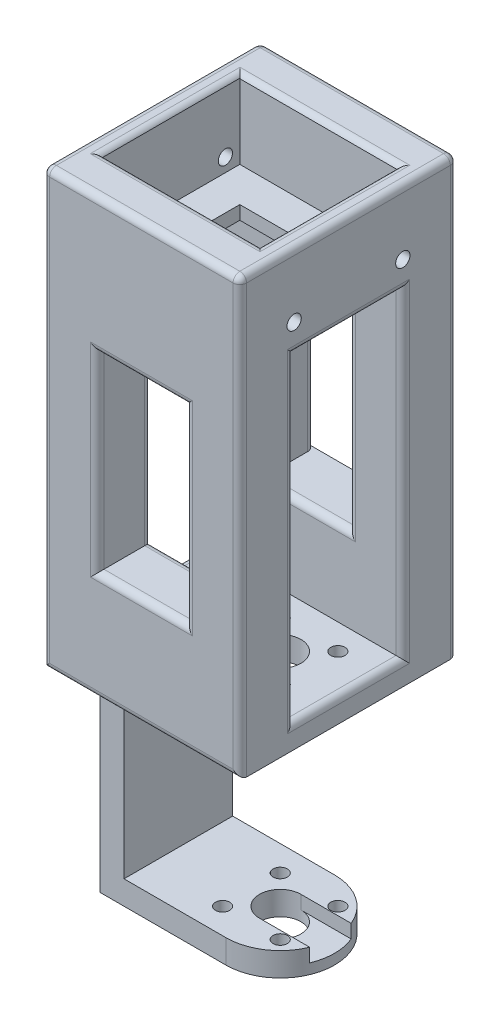
from build123d import *

# Parameters (mm, degrees)
SKETCH_1_R          = 3.05
SKETCH_1_R_2        = 1.05
EXTRUDE_1_DEPTH     = 3.5
SKETCH_2_W          = 16
SKETCH_2_H          = 36
EXTRUDE_2_DEPTH     = 3.5
EXTRUDE_4_DEPTH     = 3.5
EXTRUDE_5_DEPTH     = 8
CUT_EXTRUDE_1_REACH = 104.026
SKETCH_6_W          = 2.03
SKETCH_6_H          = 11.5
EXTRUDE_6_REACH     = 103.73
SKETCH_7_W          = 3
SKETCH_7_H          = 11.5
EXTRUDE_7_REACH     = 103.229
SKETCH_8_W          = 0.45
SKETCH_8_H          = 3.5
EXTRUDE_8_REACH     = 103.229
SKETCH_9_W          = 29
SKETCH_9_H          = 2
SKETCH_10_R         = 1.05
CUT_EXTRUDE_2_DEPTH = 31.75
CUT_EXTRUDE_3_DEPTH = 2
CUT_EXTRUDE_4_REACH = 88.626
SKETCH_13_W         = 11
SKETCH_13_H         = 10
SKETCH_14_W         = 13
SKETCH_14_H         = 28
CUT_EXTRUDE_5_DEPTH = 104.418337349
FILLET_1_R          = 1
CUT_EXTRUDE_6_DEPTH = 11.625
CUT_EXTRUDE_7_DEPTH = 10.125
CUT_EXTRUDE_8_DEPTH = 11.55


with BuildPart() as part:
    # 草图1 → 凸台-拉伸1 (new body)
    with BuildSketch(Plane(origin=(0, 0, 0), x_dir=(1, 0, 0), z_dir=(0, 1, 0))):
        with BuildLine():
            Line((0, 8), (-15, 8))
            Line((-15, 8), (-15, -8))
            Line((-15, -8), (0, -8))
            ThreePointArc((0, -8), (8, 0), (0, 8))
        make_face()
        with Locations(Location((0, 0, 0), (0, 0, 270))):
            Circle(SKETCH_1_R, mode=Mode.SUBTRACT)
        with Locations(Location((-4.242640687, 4.242640687, 0), (0, 0, 270))):
            Circle(SKETCH_1_R_2, mode=Mode.SUBTRACT)
        with Locations(Location((-4.242640687, -4.242640687, 0), (0, 0, 270))):
            Circle(SKETCH_1_R_2, mode=Mode.SUBTRACT)
        with Locations(Location((4.242640687, -4.242640687, 0), (0, 0, 90))):
            Circle(SKETCH_1_R_2, mode=Mode.SUBTRACT)
        with Locations(Location((4.242640687, 4.242640687, 0), (0, 0, 90))):
            Circle(SKETCH_1_R_2, mode=Mode.SUBTRACT)
    extrude(amount=EXTRUDE_1_DEPTH)


with BuildPart() as body_2:
    # 镜向4: mirrored copy
    add(part.part.mirror(Plane.ZX.offset(18)))


with BuildPart() as part_1:
    add(part.part)

    add(body_2.part)  # 凸台-拉伸2 merges body 2
    # 草图2 → 凸台-拉伸2 (add)
    with BuildSketch(Plane.ZY.offset(15)):
        with Locations((0, 18)):
            Rectangle(SKETCH_2_W, SKETCH_2_H)
    extrude(amount=EXTRUDE_2_DEPTH)

    # 草图4 → 凸台-拉伸4 (add)
    with BuildSketch(Plane.XZ.offset(-32.5)):
        with BuildLine():
            Line((0, 8), (10.05, 8))
            Line((10.05, 8), (10.05, -8))
            Line((10.05, -8), (0, -8))
            ThreePointArc((0, -8), (8, 0), (0, 8))
        make_face()
    extrude(amount=-EXTRUDE_4_DEPTH)

    # 草图5 → 凸台-拉伸5 (add)
    with BuildSketch(Plane.XY.offset(8)):
        Polygon((10.05, 32.5), (-18.5, 32.5), (-18.95, 32.5), (-18.95, 96.5), (-18.5, 96.5), (10.05, 96.5), align=None)
    extrude_5 = extrude(amount=EXTRUDE_5_DEPTH)

    # 镜向5: 凸台-拉伸5 across plane
    add(extrude_5.mirror(Plane.XY))

    # 草图6 → 切除-拉伸1 (cut, up to next)
    with BuildSketch(Plane(origin=(10.05, 0, 0), x_dir=(0, 0, -1), z_dir=(1, 0, 0)), mode=Mode.PRIVATE) as cut_extrude_1_sk1:
        with Locations((-9.015, 90.75)):
            Rectangle(SKETCH_6_W, SKETCH_6_H)
    cut_extrude_1_tool1 = extrude(cut_extrude_1_sk1.sketch, amount=-CUT_EXTRUDE_1_REACH, mode=Mode.PRIVATE) & part_1.part
    # 草图6 → 切除-拉伸1 (cut, up to next)
    with BuildSketch(Plane(origin=(10.05, 0, 0), x_dir=(0, 0, -1), z_dir=(1, 0, 0)), mode=Mode.PRIVATE) as cut_extrude_1_sk2:
        with Locations((9.015, 90.75)):
            Rectangle(SKETCH_6_W, SKETCH_6_H)
    cut_extrude_1_tool2 = extrude(cut_extrude_1_sk2.sketch, amount=-CUT_EXTRUDE_1_REACH, mode=Mode.PRIVATE) & part_1.part
    add(cut_extrude_1_tool1.solids().sort_by_distance((10.05, 90.75, 9.015))[0], mode=Mode.SUBTRACT)
    add(cut_extrude_1_tool2.solids().sort_by_distance((10.05, 90.75, -9.015))[0], mode=Mode.SUBTRACT)

    # 草图7 → 凸台-拉伸6 (add, up to next)
    with BuildSketch(Plane(origin=(0, 0, 10.03), x_dir=(-1, 0, 0), z_dir=(0, 0, -1)), mode=Mode.PRIVATE) as extrude_6_sk1:
        with Locations((17.45, 90.75)):
            Rectangle(SKETCH_7_W, SKETCH_7_H)
    extrude_6_tool1 = extrude(extrude_6_sk1.sketch, amount=EXTRUDE_6_REACH, mode=Mode.PRIVATE) - part_1.part
    # 草图7 → 凸台-拉伸6 (add, up to next)
    with BuildSketch(Plane(origin=(0, 0, 10.03), x_dir=(-1, 0, 0), z_dir=(0, 0, -1)), mode=Mode.PRIVATE) as extrude_6_sk2:
        with Locations((-8.55, 90.75)):
            Rectangle(SKETCH_7_W, SKETCH_7_H)
    extrude_6_tool2 = extrude(extrude_6_sk2.sketch, amount=EXTRUDE_6_REACH, mode=Mode.PRIVATE) - part_1.part
    add(extrude_6_tool1.solids().sort_by_distance((-17.45, 90.75, 10.03))[0])
    add(extrude_6_tool2.solids().sort_by_distance((8.55, 90.75, 10.03))[0])

    # 草图8 → 凸台-拉伸7 (add, up to next)
    with BuildSketch(Plane.XY.offset(-8), mode=Mode.PRIVATE) as extrude_7_sk1:
        with Locations((-18.725, 34.25)):
            Rectangle(SKETCH_8_W, SKETCH_8_H)
    extrude_7_tool1 = extrude(extrude_7_sk1.sketch, amount=EXTRUDE_7_REACH, mode=Mode.PRIVATE) - part_1.part
    add(extrude_7_tool1.solids().sort_by_distance((-18.725, 34.25, -8))[0])

    # 草图9 → 凸台-拉伸8 (add, up to next)
    with BuildSketch(Plane.XY.offset(-8), mode=Mode.PRIVATE) as extrude_8_sk1:
        with Locations((-4.45, 84)):
            Rectangle(SKETCH_9_W, SKETCH_9_H)
    extrude_8_tool1 = extrude(extrude_8_sk1.sketch, amount=EXTRUDE_8_REACH, mode=Mode.PRIVATE) - part_1.part
    add(extrude_8_tool1.solids().sort_by_distance((-4.45, 84, -8))[0])

    # 草图10 → 切除-拉伸2 (cut, symmetric)
    with BuildSketch(Plane(origin=(-15.95, 0, 0), x_dir=(0, 0, -1), z_dir=(1, 0, 0))):
        with Locations(Location((-8, 87, 0), (0, 0, 180))):
            Circle(SKETCH_10_R)
        with Locations(Location((8, 87, 0), (0, 0, 180))):
            Circle(SKETCH_10_R)
    extrude(amount=CUT_EXTRUDE_2_DEPTH, both=True, mode=Mode.SUBTRACT)

    # 草图12 → 切除-拉伸3 (cut)
    with BuildSketch(Plane(origin=(0, 3.5, 0), x_dir=(1, 0, 0), z_dir=(0, 1, 0))):
        with BuildLine():
            Line((0, 3.05), (11.782657366, 3.05))
            Line((11.782657366, 3.05), (11.782657366, -3.05))
            Line((11.782657366, -3.05), (0, -3.05))
            ThreePointArc((0, -3.05), (3.05, 0), (0, 3.05))
        make_face()
    extrude(amount=-CUT_EXTRUDE_3_DEPTH, mode=Mode.SUBTRACT)

    # 草图13 → 切除-拉伸4 (cut, up to next)
    with BuildSketch(Plane.XZ.offset(-83), mode=Mode.PRIVATE) as cut_extrude_4_sk1:
        with Locations((-5.45, 0)):
            Rectangle(SKETCH_13_W, SKETCH_13_H)
    cut_extrude_4_tool1 = extrude(cut_extrude_4_sk1.sketch, amount=-CUT_EXTRUDE_4_REACH, mode=Mode.PRIVATE) & part_1.part
    add(cut_extrude_4_tool1.solids().sort_by_distance((-5.45, 83, 0))[0], mode=Mode.SUBTRACT)

    # 草图14 → 切除-拉伸5 (cut, through all)
    with BuildSketch(Plane(origin=(0, 0, -16), x_dir=(-1, 0, 0), z_dir=(0, 0, -1))):
        with Locations((4.45, 62.5)):
            Rectangle(SKETCH_14_W, SKETCH_14_H)
    extrude(amount=-CUT_EXTRUDE_5_DEPTH, mode=Mode.SUBTRACT)

    # 圆角1
    fillet_1_edges = [part_1.edges().sort_by_distance(p)[0] for p in [
        (-4.45, 96.5, -16),
        (10.05, 64.5, -16),
        (-4.45, 32.5, -16),
        (-18.95, 64.5, -16),
        (-4.45, 96.5, 10.03),
        (-4.45, 96.5, -10.03),
        (-15.95, 96.5, 0),
        (7.05, 96.5, 0),
        (-18.95, 36, 0),
        (-18.95, 59.5, 8),
        (-18.95, 59.5, -8),
        (-18.95, 83, 0),
        (10.05, 83, 0),
        (2.05, 62.5, 8),
        (2.05, 62.5, -8),
        (2.05, 62.5, 16),
        (-4.45, 76.5, 8),
        (-4.45, 76.5, -8),
        (-4.45, 76.5, 16),
        (-10.95, 62.5, 8),
        (-10.95, 62.5, -8),
        (-10.95, 62.5, 16),
        (-4.45, 48.5, 8),
        (-4.45, 48.5, -8),
        (-4.45, 48.5, 16),
        (-10.95, 62.5, -16),
        (-4.45, 76.5, -16),
        (10.05, 36, 0),
        (-18.95, 96.5, 0),
        (10.05, 59.5, 8),
        (10.05, 96.5, 0),
        (-4.45, 96.5, 16),
        (-18.95, 64.5, 16),
        (-4.45, 32.5, 16),
        (10.05, 64.5, 16),
        (10.05, 59.5, -8),
    ]]
    fillet(fillet_1_edges, radius=FILLET_1_R)

    # 草图16 → 切除-拉伸6 (cut, symmetric)
    with BuildSketch(Plane.ZY.offset(4.45)):
        Polygon((-10.03, 95.5), (-10.03, 98.360674074), (10.03, 98.360674074), (10.03, 95.5), (10.03, 85), (-10.03, 85), align=None)
    extrude(amount=CUT_EXTRUDE_6_DEPTH, both=True, mode=Mode.SUBTRACT)

    # 草图17 → 切除-拉伸7 (cut, symmetric)
    with BuildSketch(Plane.XY):
        Polygon((-16.075, 95.984122918), (-15.913726203, 99.204392549), (7.175, 98.048089827), (7.175, 95.984122918), (7.175, 85), (-16.075, 85), align=None)
    extrude(amount=CUT_EXTRUDE_7_DEPTH, both=True, mode=Mode.SUBTRACT)

    # 草图19 → 切除-拉伸8 (cut, symmetric)
    with BuildSketch(Plane(origin=(-4.45, 0, 0), x_dir=(0, 0, -1), z_dir=(1, 0, 0))):
        Polygon((-10.125, 95.984122918), (-10.125, 99.965715237), (10.09, 99.965715237), (10.125, 95.984122918), (10.125, 85), (-10.125, 85), align=None)
    extrude(amount=CUT_EXTRUDE_8_DEPTH, both=True, mode=Mode.SUBTRACT)


solid = part_1.part
